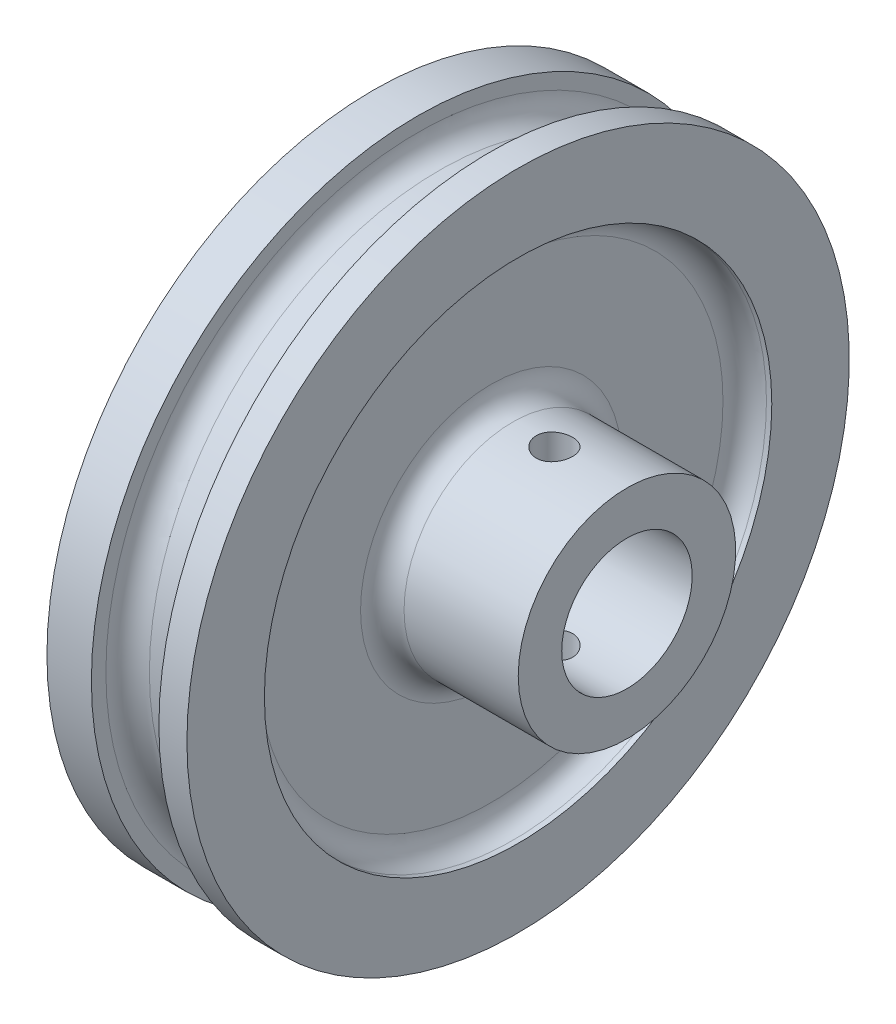
from build123d import *

# Parameters (mm, degrees)
SKETCH2_R          = 2.5
CUT_EXTRUDE1_DEPTH = 79.914255008


with BuildPart() as part:
    # Sketch1 → Revolve2 (revolve)
    with BuildSketch(Plane.XY, mode=Mode.PRIVATE) as revolve2_sk:
        with BuildLine():
            Line((-13.637604781, 9), (21.379821609, 9))
            Line((21.379821609, 9), (21.379821609, 15))
            Line((21.379821609, 15), (5.627244289, 15))
            ThreePointArc((5.627244289, 15), (3.505923946, 15.878679656), (2.627244289, 18))
            Line((2.627244289, 18), (2.627244289, 32))
            ThreePointArc((2.627244289, 32), (3.505923946, 34.121320344), (5.627244289, 35))
            Line((5.627244289, 35), (6.362395219, 35))
            Line((6.362395219, 35), (6.362395219, 45.687700042))
            Line((6.362395219, 45.687700042), (2.494845361, 45.687700042))
            Line((2.494845361, 45.687700042), (2.494845361, 43))
            ThreePointArc((2.494845361, 43), (1.616165704, 40.878679656), (-0.505154639, 40))
            Line((-0.505154639, 40), (-4.505154639, 40))
            ThreePointArc((-4.505154639, 40), (-6.626474983, 40.878679656), (-7.505154639, 43))
            Line((-7.505154639, 43), (-7.505154639, 45))
            Line((-7.505154639, 45), (-13.637604781, 45))
            Line((-13.637604781, 45), (-13.637604781, 9))
        make_face()
    revolve(revolve2_sk.sketch.rotate(Axis((-27.298969072, 0, 0), (1, 0, 0)), 90), axis=Axis((-27.298969072, 0, 0), (1, 0, 0)))

    # Sketch2 → Cut-Extrude1 (cut, through all)
    with BuildSketch(Plane(origin=(0, 15, 0), x_dir=(1, 0, 0), z_dir=(0, 1, 0))):
        with Locations(Location((11.379821609, 0, 0), (0, 0, 270))):
            Circle(SKETCH2_R)
    extrude(amount=-CUT_EXTRUDE1_DEPTH, mode=Mode.SUBTRACT)


solid = part.part
